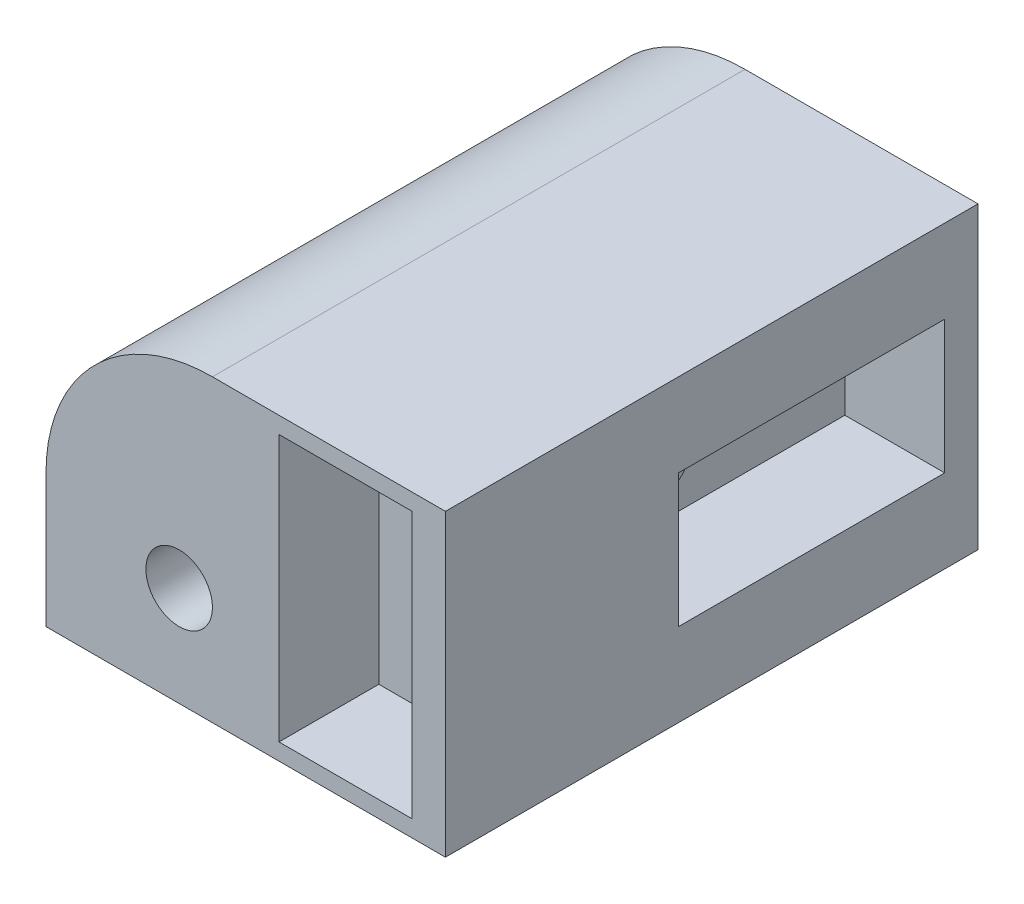
from build123d import *

# Parameters (mm, degrees)
SKETCH1_W           = 76.2
SKETCH1_H           = 57.15
SKETCH1_R           = 6.35
BOSS_EXTRUDE1_DEPTH = 101.6
SKETCH2_W           = 50.8
SKETCH2_H           = 25.4
CUT_EXTRUDE1_DEPTH  = 19.05
SKETCH3_W           = 25.4
SKETCH3_H           = 50.8
CUT_EXTRUDE2_DEPTH  = 19.05
SKETCH4_R           = 6.35
BOSS_EXTRUDE2_DEPTH = 2.54
FILLET1_R           = 31.75


with BuildPart() as part:
    # Sketch1 → Boss-Extrude1 (new body)
    with BuildSketch(Plane.XY):
        with Locations((20.469038702, 9.873813983)):
            Rectangle(SKETCH1_W, SKETCH1_H)
        with Locations((7.769038702, 0.348813983)):
            Circle(SKETCH1_R, mode=Mode.SUBTRACT)
    extrude(amount=BOSS_EXTRUDE1_DEPTH)

    # Sketch2 → Cut-Extrude1 (cut)
    with BuildSketch(Plane.ZY.offset(-58.569038702)):
        with Locations((31.75, 9.873813983)):
            Rectangle(SKETCH2_W, SKETCH2_H)
    extrude(amount=CUT_EXTRUDE1_DEPTH, mode=Mode.SUBTRACT)

    # Sketch3 → Cut-Extrude2 (cut)
    with BuildSketch(Plane.XY.offset(101.6)):
        with Locations((39.519038702, 9.873813983)):
            Rectangle(SKETCH3_W, SKETCH3_H)
    extrude(amount=-CUT_EXTRUDE2_DEPTH, mode=Mode.SUBTRACT)

    # Sketch4 → Boss-Extrude2 (add)
    with BuildSketch(Plane(origin=(39.519038702, 0, 0), x_dir=(0, 0, -1), z_dir=(1, 0, 0))):
        with Locations(Location((-44.45, 9.873813983, 0), (0, 0, 270))):
            Circle(SKETCH4_R)
    extrude(amount=BOSS_EXTRUDE2_DEPTH)

    # Fillet1
    fillet1_edges = [part.edges().sort_by_distance(p)[0] for p in [
        (-17.630961298, 38.448813983, 50.8),
    ]]
    fillet(fillet1_edges, radius=FILLET1_R)


solid = part.part
